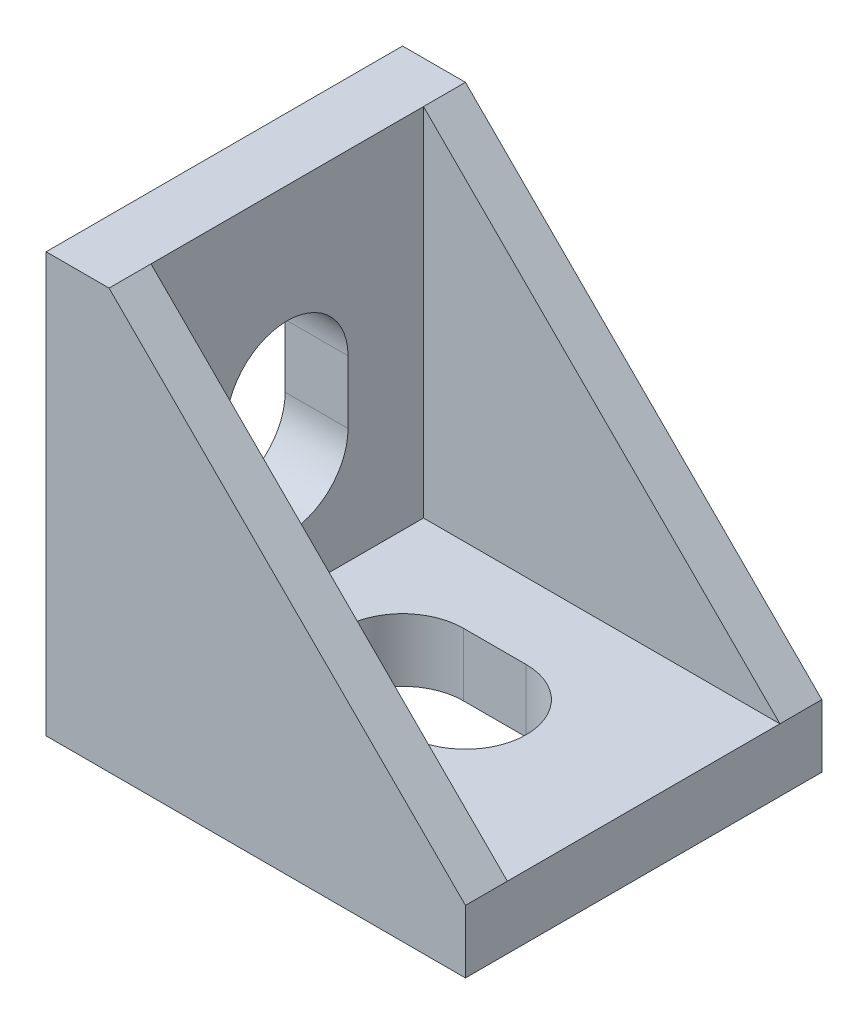
from build123d import *

# Parameters (mm, degrees)
BOSS_EXTRUDE1_DEPTH = 8.5
CUT_EXTRUDE1_START  = -2
CUT_EXTRUDE1_DEPTH  = 13
CUT_EXTRUDE2_DEPTH  = 28.590759323
CUT_EXTRUDE3_DEPTH  = 28.590759323
SKETCH5_W           = 4
SKETCH5_H           = 1.85
BOSS_EXTRUDE2_DEPTH = 1
SKETCH6_W           = 1.85
SKETCH6_H           = 4
BOSS_EXTRUDE3_DEPTH = 1


with BuildPart() as part:
    # Sketch1 → Boss-Extrude1 (new, symmetric)
    with BuildSketch(Plane.XY):
        Polygon((0, 0), (0, 20), (3, 20), (20, 3), (20, 0), align=None)
    extrude(amount=BOSS_EXTRUDE1_DEPTH, both=True)

    # Sketch2 → Cut-Extrude1 (cut)
    with BuildSketch(Plane.XY.offset(8.5).offset(CUT_EXTRUDE1_START)):
        Polygon((3, 20), (3, 3), (20, 3), align=None)
    extrude(amount=-CUT_EXTRUDE1_DEPTH, mode=Mode.SUBTRACT)

    # Sketch3 → Cut-Extrude2 (cut, through all)
    with BuildSketch(Plane(origin=(3, 0, 0), x_dir=(0, 0, -1), z_dir=(1, 0, 0))):
        with BuildLine():
            Line((2.9, 11.5), (2.9, 8.5))
            ThreePointArc((2.9, 8.5), (0, 5.6), (-2.9, 8.5))
            Line((-2.9, 8.5), (-2.9, 11.5))
            ThreePointArc((-2.9, 11.5), (0, 14.4), (2.9, 11.5))
        make_face()
    extrude(amount=-CUT_EXTRUDE2_DEPTH, mode=Mode.SUBTRACT)

    # Sketch4 → Cut-Extrude3 (cut, through all)
    with BuildSketch(Plane(origin=(0, 3, 0), x_dir=(1, 0, 0), z_dir=(0, 1, 0))):
        with BuildLine():
            Line((11.5, -2.9), (8.5, -2.9))
            ThreePointArc((8.5, -2.9), (5.6, 0), (8.5, 2.9))
            Line((8.5, 2.9), (11.5, 2.9))
            ThreePointArc((11.5, 2.9), (14.4, 0), (11.5, -2.9))
        make_face()
    extrude(amount=-CUT_EXTRUDE3_DEPTH, mode=Mode.SUBTRACT)

    # Sketch5 → Boss-Extrude2 (add)
    with BuildSketch(Plane.ZY):
        with Locations((0, 17.575)):
            Rectangle(SKETCH5_W, SKETCH5_H)
        with Locations((0, 2.425)):
            Rectangle(SKETCH5_W, SKETCH5_H)
    extrude(amount=BOSS_EXTRUDE2_DEPTH)

    # Sketch6 → Boss-Extrude3 (add)
    with BuildSketch(Plane.XZ):
        with Locations((2.425, 0)):
            Rectangle(SKETCH6_W, SKETCH6_H)
        with Locations((17.575, 0)):
            Rectangle(SKETCH6_W, SKETCH6_H)
    extrude(amount=BOSS_EXTRUDE3_DEPTH)


solid = part.part
